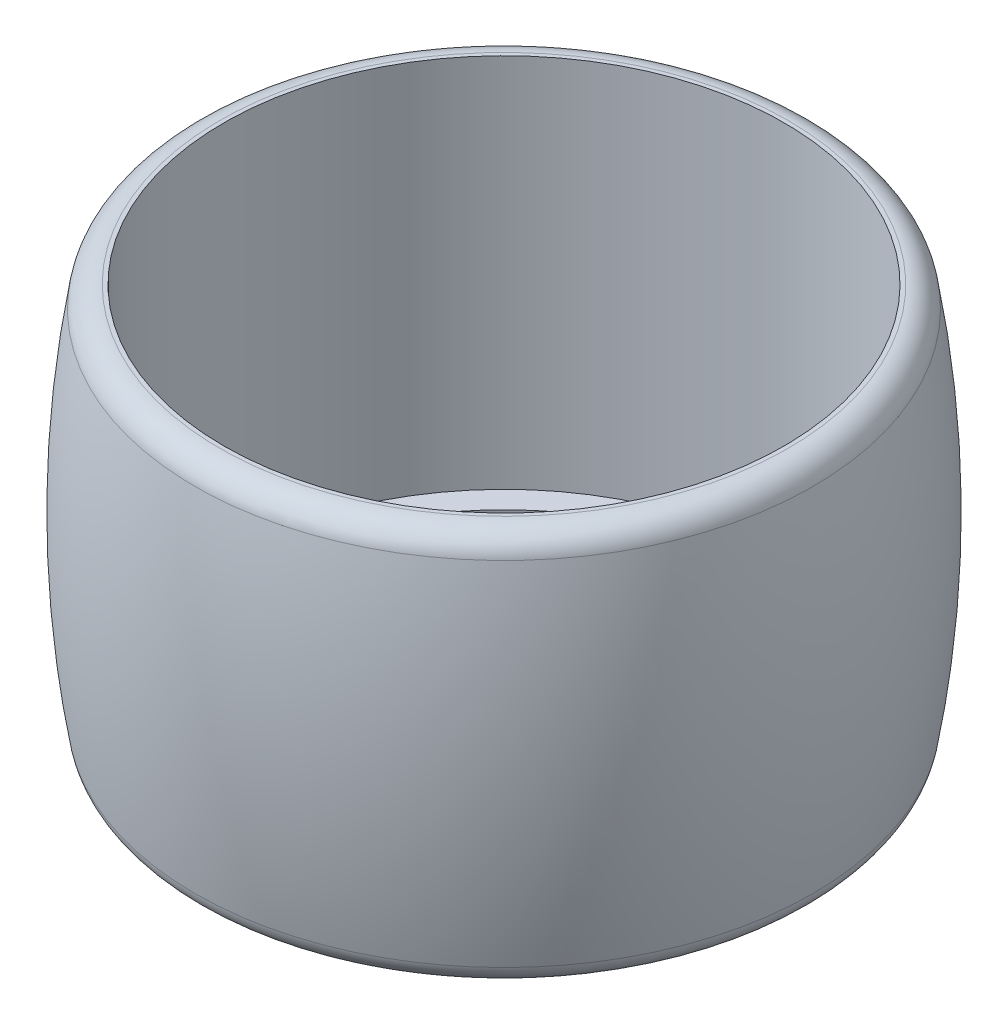
from build123d import *

# Parameters (mm, degrees)
FILLET1_R = 2


with BuildPart() as part:
    # Sketch1 → Revolve3 (revolve)
    with BuildSketch(Plane.XY, mode=Mode.PRIVATE) as revolve3_sk:
        with BuildLine():
            Line((20.45, -14.3), (22.45, -14.3))
            Line((22.45, -14.3), (22.45, 15.8))
            Line((22.45, 15.8), (24.45, 15.8))
            ThreePointArc((24.45, 15.8), (25.915321684, 0), (24.45, -15.8))
            Line((24.45, -15.8), (20.45, -15.8))
            Line((20.45, -15.8), (20.45, -14.3))
        make_face()
    revolve(revolve3_sk.sketch.rotate(Axis((0, 7.38603037, 0), (0, -1, 0)), 90), axis=Axis((0, 7.38603037, 0), (0, -1, 0)))

    # Fillet1
    fillet1_edges = [part.edges().sort_by_distance(p)[0] for p in [
        (0, -15.8, -24.45),
        (0, 15.8, -24.45),
    ]]
    fillet(fillet1_edges, radius=FILLET1_R)


solid = part.part
